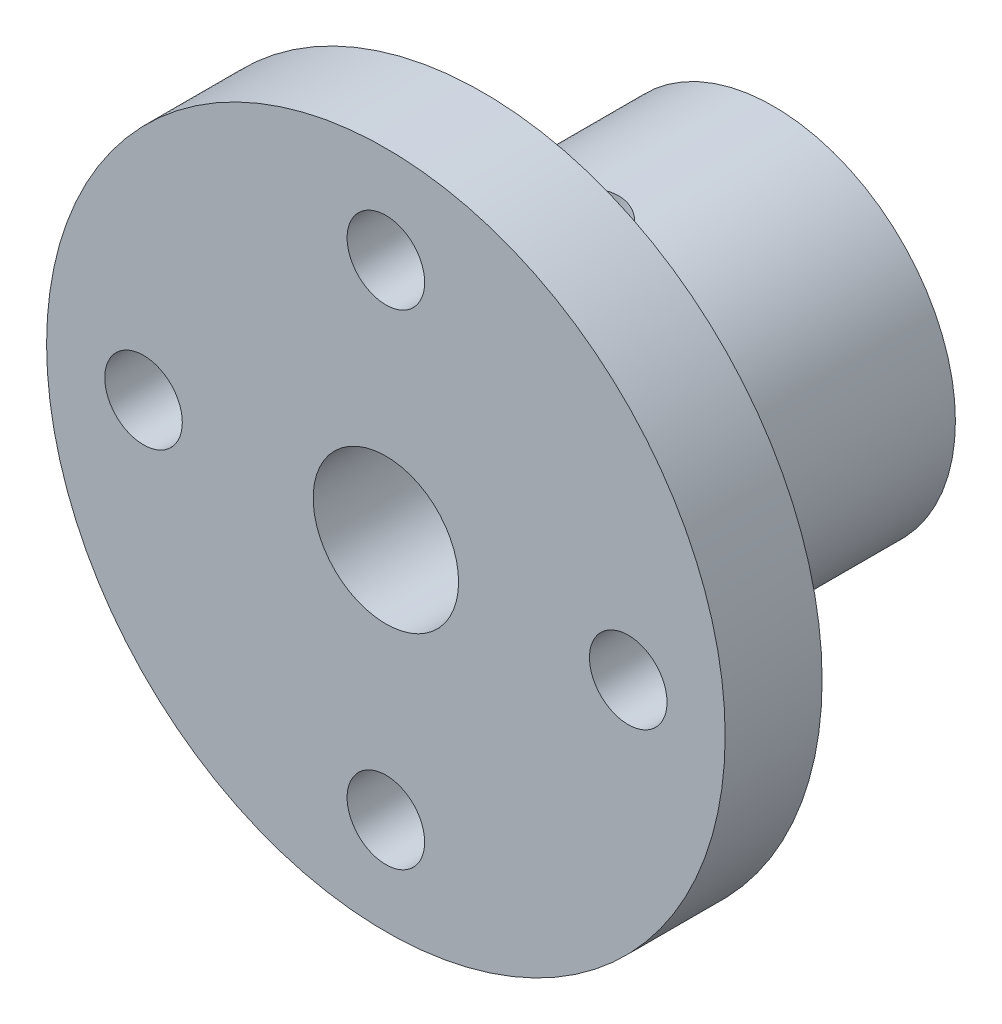
from build123d import *

# Parameters (mm, degrees)
SKETCH_1_R          = 7.5
EXTRUDE_1_DEPTH     = 16
SKETCH_2_R          = 14
EXTRUDE_2_DEPTH     = 4
SKETCH_3_R          = 3
SKETCH_3_R_2        = 1.6
CUT_EXTRUDE_1_DEPTH = 26.455844123
SKETCH_4_R          = 1.6
CUT_EXTRUDE_2_DEPTH = 7.5


with BuildPart() as part:
    # ｽｹｯﾁ1 → ﾎﾞｽ - 押し出し1 (new body)
    with BuildSketch(Plane.XY):
        Circle(SKETCH_1_R)
    extrude(amount=-EXTRUDE_1_DEPTH)

    # ｽｹｯﾁ2 → ﾎﾞｽ - 押し出し2 (add)
    with BuildSketch(Plane.XY):
        Circle(SKETCH_2_R)
    extrude(amount=-EXTRUDE_2_DEPTH)

    # ｽｹｯﾁ3 → ｶｯﾄ - 押し出し1 (cut, through all)
    with BuildSketch(Plane.XY):
        Circle(SKETCH_3_R)
        with Locations((10, 0)):
            Circle(SKETCH_3_R_2)
        with Locations((0, -10)):
            Circle(SKETCH_3_R_2)
        with Locations((-10, 0)):
            Circle(SKETCH_3_R_2)
        with Locations((0, 10)):
            Circle(SKETCH_3_R_2)
    extrude(amount=-CUT_EXTRUDE_1_DEPTH, mode=Mode.SUBTRACT)

    # ｽｹｯﾁ4 → ｶｯﾄ - 押し出し2 (cut)
    with BuildSketch(Plane(origin=(0, 7.5, 0), x_dir=(1, 0, 0), z_dir=(0, 1, 0))):
        with Locations(Location((0, 8, 0), (0, 0, 270))):
            Circle(SKETCH_4_R)
    extrude(amount=-CUT_EXTRUDE_2_DEPTH, mode=Mode.SUBTRACT)


solid = part.part
